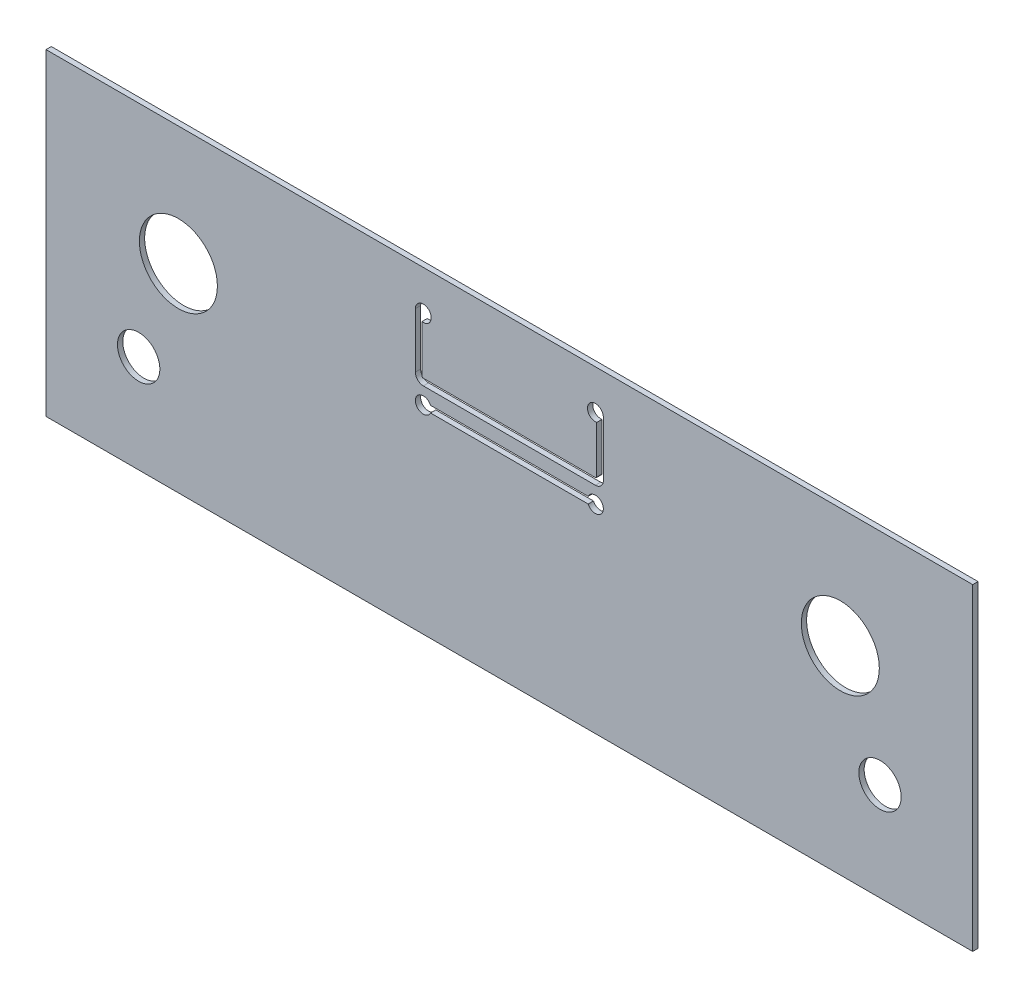
from build123d import *

# Parameters (mm, degrees)
SKETCH1_W           = 35
SKETCH1_H           = 12
SKETCH1_R           = 0.8001
SKETCH1_R_2         = 1.4732
BOSS_EXTRUDE1_DEPTH = 0.2


with BuildPart() as part:
    # Sketch1 → Boss-Extrude1 (new body)
    with BuildSketch(Plane.XY):
        with Locations((17.5, -6)):
            Rectangle(SKETCH1_W, SKETCH1_H)
        with Locations((3.5, -8.3)):
            Circle(SKETCH1_R, mode=Mode.SUBTRACT)
        with Locations((5, -4.5)):
            Circle(SKETCH1_R_2, mode=Mode.SUBTRACT)
        with Locations((30, -4.5)):
            Circle(SKETCH1_R_2, mode=Mode.SUBTRACT)
        with Locations((31.5, -8.3)):
            Circle(SKETCH1_R, mode=Mode.SUBTRACT)
        with BuildLine():
            Line((14.2, -1.795803989), (14.2, -3.575))
            ThreePointArc((14.2, -3.575), (14.214644661, -3.610355339), (14.25, -3.625))
            Line((14.25, -3.625), (20.75, -3.625))
            ThreePointArc((20.75, -3.625), (20.785355339, -3.610355339), (20.8, -3.575))
            Line((20.8, -3.575), (20.8, -1.795803989))
            ThreePointArc((20.8, -1.795803989), (20.520871215, -1.306350833), (21.05, -1.5))
            Line((21.05, -1.5), (21.05, -3.575))
            ThreePointArc((21.05, -3.575), (20.962132034, -3.787132034), (20.75, -3.875))
            Line((20.75, -3.875), (14.25, -3.875))
            ThreePointArc((14.25, -3.875), (14.037867966, -3.787132034), (13.95, -3.575))
            Line((13.95, -3.575), (13.95, -1.5))
            ThreePointArc((13.95, -1.5), (14.479128785, -1.306350833), (14.2, -1.795803989))
        make_face(mode=Mode.SUBTRACT)
        with BuildLine():
            Line((20.477282197, -4.375), (14.522717803, -4.375))
            ThreePointArc((14.522717803, -4.375), (13.95, -4.5), (14.522717803, -4.625))
            Line((14.522717803, -4.625), (20.477282197, -4.625))
            ThreePointArc((20.477282197, -4.625), (21.05, -4.5), (20.477282197, -4.375))
        make_face(mode=Mode.SUBTRACT)
    extrude(amount=BOSS_EXTRUDE1_DEPTH)


solid = part.part
